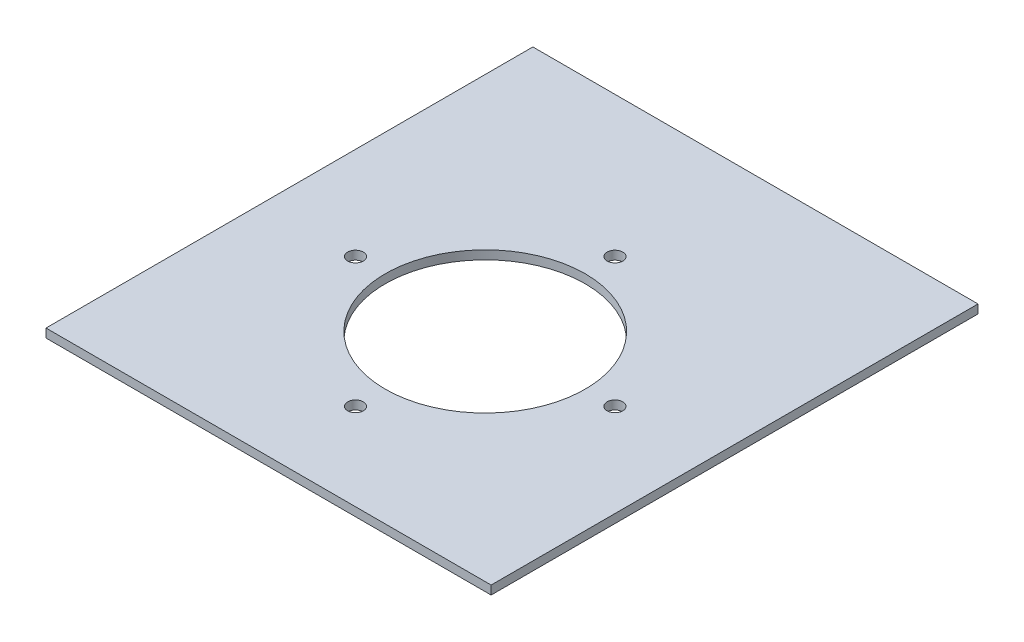
from build123d import *

# Parameters (mm, degrees)
SZKIC1_W                    = 256
SZKIC1_H                    = 280
DODANIE_WYCI_GNI_CIE1_DEPTH = 5
SZKIC2_R                    = 57.5
SZKIC2_R_2                  = 4.5
WYTNIJ_WYCI_GNI_CIE1_DEPTH  = 5


with BuildPart() as part:
    # Szkic1 → Dodanie-wyciągnięcie1 (new body)
    with BuildSketch(Plane(origin=(0, 0, 0), x_dir=(1, 0, 0), z_dir=(0, 1, 0))):
        with Locations((128, 140)):
            Rectangle(SZKIC1_W, SZKIC1_H)
    extrude(amount=DODANIE_WYCI_GNI_CIE1_DEPTH)

    # Szkic2 → Wytnij-wyciągnięcie1 (cut)
    with BuildSketch(Plane(origin=(0, 5, 0), x_dir=(1, 0, 0), z_dir=(0, 1, 0))):
        with Locations(Location((128, 124.6, 0), (0, 0, 270))):
            Circle(SZKIC2_R)
        with Locations(Location((128, 199.2, 0), (0, 0, 270))):
            Circle(SZKIC2_R_2)
        with Locations(Location((202.6, 124.6, 0), (0, 0, 270))):
            Circle(SZKIC2_R_2)
        with Locations(Location((128, 50, 0), (0, 0, 270))):
            Circle(SZKIC2_R_2)
        with Locations(Location((53.4, 124.6, 0), (0, 0, 270))):
            Circle(SZKIC2_R_2)
    extrude(amount=-WYTNIJ_WYCI_GNI_CIE1_DEPTH, mode=Mode.SUBTRACT)


solid = part.part
